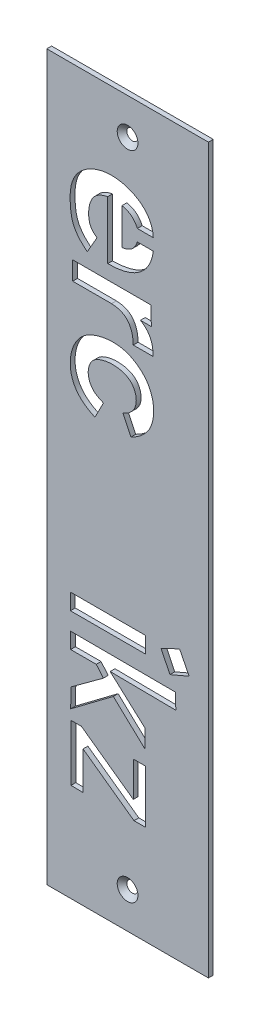
from build123d import *

# Parameters (mm, degrees)
SKIZZE2_W                                   = 67
SKIZZE2_H                                   = 300
AUFSATZ_LINEAR_AUSTRAGEN1_DEPTH             = 2
FORMSENKUNG_F_R_M4_SENKSCHRAUBE_MIT_2_COUNT = 2
FORMSENKUNG_F_R_M4_SENKSCHRAUBE_MIT_2_PITCH = 270
SKIZZE9_W                                   = 31.10502621
SKIZZE9_H                                   = 6.710582317
SCHNITT_LINEAR_AUSTRAGEN5_DEPTH             = 10


with BuildPart() as part:
    # Skizze2 → Aufsatz-Linear austragen1 (new body)
    with BuildSketch(Plane.XY):
        with Locations((30.454545455, -53.853438228)):
            Rectangle(SKIZZE2_W, SKIZZE2_H)
    extrude(amount=AUFSATZ_LINEAR_AUSTRAGEN1_DEPTH)

    # Skizze4 → Formsenkung für M4 Senkschraube mit Innensechskant1 (revolve, cut)
    with BuildSketch(Plane(origin=(30.454545455, 81.146561772, 2), x_dir=(0, -1, 0), z_dir=(1, 0, 0))):
        Polygon((0, 0), (0, 2), (2.25, 2), (2.25, 2.05), (4.3, 0), align=None)
    formsenkung_f_r_m4_senkschraube_mit_inne = revolve(axis=Axis((30.454545455, 81.146561772, 8.35), (0, 0, -1)), mode=Mode.SUBTRACT)

    # Formsenkung f_r M4 Senkschraube mit  2: Formsenkung für M4 Senkschraube mit Innensechskant1 ×2
    with Locations(*[(0, -i * FORMSENKUNG_F_R_M4_SENKSCHRAUBE_MIT_2_PITCH, 0) for i in range(1, FORMSENKUNG_F_R_M4_SENKSCHRAUBE_MIT_2_COUNT)]):
        add(formsenkung_f_r_m4_senkschraube_mit_inne, mode=Mode.SUBTRACT)

    # Skizze9 → Schnitt-Linear austragen5 (cut)
    with BuildSketch(Plane.XY.offset(2)):
        Polygon((52.001558097, -91.692267967), (55.954864906, -99.53078632), (48.017183689, -102.940874601), (44.331709582, -95.41361182), align=None)
        with Locations((22.311332276, -97.288736457)):
            Rectangle(SKIZZE9_W, SKIZZE9_H)
        Polygon((6.758819171, -107.925887397), (50.350445865, -108.08808674), (50.427715289, -114.508189206), (23.217156686, -114.214287256), (37.758627479, -127.374767162), (37.758627479, -134.920795826), (24.5330538, -122.513026823), (6.876063428, -135.792670476), (6.986282299, -127.867340204), (20.398215233, -118.033810853), (17.474377356, -114.508189206), (6.841373177, -114.508189206), align=None)
        Polygon((32.81378197, -140.833783467), (37.956076493, -140.833783467), (37.863845381, -162.808656047), (33.104263457, -162.808656047), (12.007535601, -147.611290016), (12.007535601, -163.287666955), (6.986282299, -163.203737544), (6.986282299, -139.845285888), (11.322896284, -139.845285888), (32.81378197, -155.326589829), align=None)
        with BuildLine():
            Line((7.689666718, 25.787766367), (7.689666718, 18.106787224))
            Line((7.689666718, 18.106787224), (23.794942522, 18.106787224))
            add(Edge.make_bspline(
                [(23.794942522, 18.106787224), (32.601188558, 17.824016107), (32.801302406, 7.750150648)],
                knots=[0, 0, 0, 1, 1, 1], degree=2))
            Line((32.801302406, 7.750150648), (41.012907208, 7.750150648))
            add(Edge.make_bspline(
                [(35.769786279, 18.106787224), (41.216248983, 15.059838558), (41.012907208, 7.750150648)],
                knots=[0, 0, 0, 1, 1, 1], degree=2))
            Line((35.769786279, 18.106787224), (40.309969546, 18.106787224))
            Line((40.309969546, 18.106787224), (40.091631389, 25.787766367))
            Line((40.091631389, 25.787766367), (7.689666718, 25.787766367))
        make_face()
        with BuildLine():
            Line((28.488917876, -18.770250647), (31.817381195, -25.78965933))
            add(Edge.make_bspline(
                [(31.817381195, -25.78965933), (35.498176655, -24.019055478), (42.40530325, -18.074227702), (41.213657778, -2.009478612), (30.919016285, 4.141303213), (22.776211659, 4.831375661), (17.572864113, 3.89204048), (9.441685379, -0.413341636), (6.135963941, -7.921355494), (7.32226522, -18.888063748), (11.205018419, -23.673518651), (16.923657697, -26.06530754)],
                knots=[0, 0, 0, 0, 0.119409873, 0.27925359, 0.419931345, 0.450283778, 0.568056354, 0.605462622, 0.786940191, 0.828662398, 1, 1, 1, 1], degree=3))
            Line((16.923657697, -26.06530754), (20.431478316, -19.245299659))
            add(Edge.make_bspline(
                [(20.431478316, -19.245299659), (18.529961715, -18.448815365), (16.619467923, -17.425214119), (13.813302006, -13.511550753), (14.121204554, -6.483932431), (18.310146069, -4.418568869), (22.673204949, -3.485417269), (24.799039205, -3.418559428), (28.73741634, -3.960815369), (33.231832404, -6.011813728), (34.58703032, -11.56981876), (32.747718821, -16.344485846), (30.562040823, -18.053193176), (28.488917876, -18.770250647)],
                knots=[0, 0, 0, 0, 0.057281263, 0.077975222, 0.206939595, 0.4121179, 0.446671031, 0.540715366, 0.566135351, 0.689115335, 0.842004928, 0.873093394, 1, 1, 1, 1], degree=3))
        make_face()
        with BuildLine():
            Line((22.182559591, 55.683464558), (22.182559591, 31.646286217))
            add(Edge.make_bspline(
                [(22.182559591, 31.646286217), (28.285199554, 31.688242642), (36.493541258, 34.092996652), (40.550526158, 41.167443579), (41.105027709, 45.591258556)],
                knots=[0, 0, 0, 0, 0.555389856, 1, 1, 1, 1], degree=3))
            Line((41.105027709, 45.591258556), (34.50379781, 45.591258556))
            add(Edge.make_bspline(
                [(28.120055334, 40.440191437), (33.016316255, 40.899947408), (34.50379781, 45.591258556)],
                knots=[0, 0, 0, 1, 1, 1], degree=2))
            Line((28.120055334, 40.440191437), (28.120055334, 55.446553709))
            add(Edge.make_bspline(
                [(28.120055334, 55.446553709), (32.650059687, 54.608093435), (34.50379781, 50.422414638)],
                knots=[0, 0, 0, 1, 1, 1], degree=2))
            Line((34.50379781, 50.422414638), (41.104275737, 50.422414638))
            add(Edge.make_bspline(
                [(13.75926765, 31.756110501), (12.069853486, 33.007836098), (8.027031384, 37.003253409), (6.523132286, 43.013028309), (6.628333317, 56.311278281), (15.261430342, 63.498214031), (30.12062724, 65.215358583), (40.774477596, 58.523780449), (41.104275737, 50.422414638)],
                knots=[0, 0, 0, 0, 0.09000754, 0.234551371, 0.339423329, 0.540898393, 0.687756002, 1, 1, 1, 1], degree=3))
            Line((13.75926765, 31.756110501), (17.814541142, 38.76818417))
            add(Edge.make_bspline(
                [(17.814541142, 38.76818417), (15.599033207, 40.145840228), (13.917486025, 43.782276328), (14.533611479, 51.295203557), (17.892855837, 54.819575464), (22.182559591, 55.683464558)],
                knots=[0, 0, 0, 0, 0.22087745, 0.573734075, 1, 1, 1, 1], degree=3))
        make_face()
    extrude(amount=-SCHNITT_LINEAR_AUSTRAGEN5_DEPTH, mode=Mode.SUBTRACT)


solid = part.part
